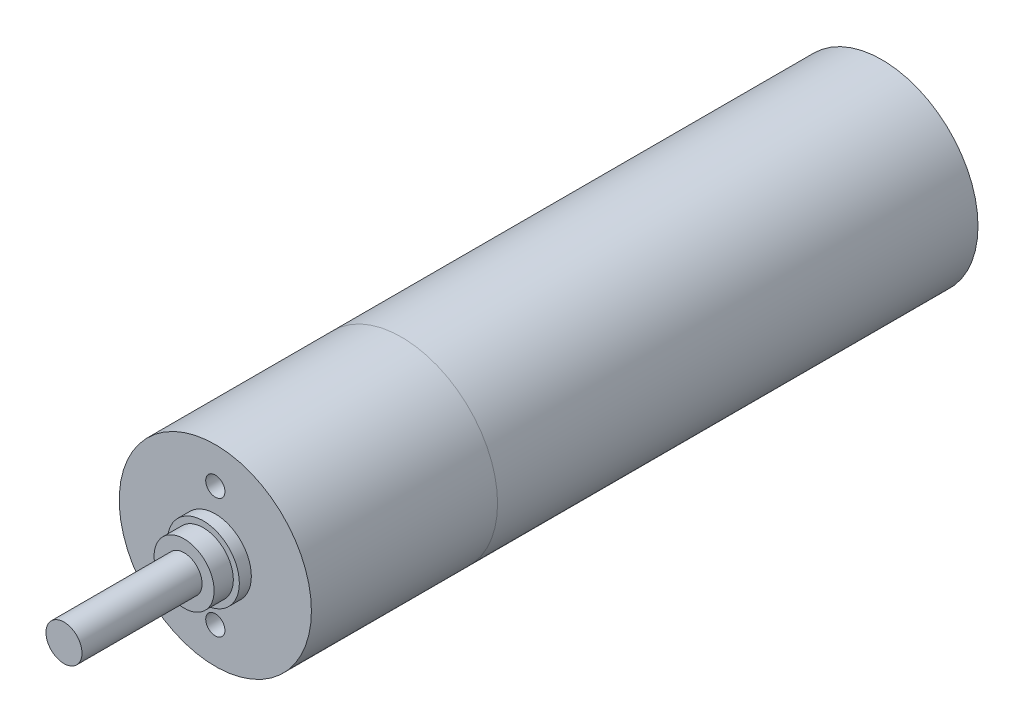
from build123d import *

# Parameters (mm, degrees)
SKETCH1_R                  = 8
EXTRUDE1_DEPTH             = 40
SKETCH2_R                  = 8
EXTRUDE2_DEPTH             = 15.5
SKETCH3_R                  = 3
EXTRUDE3_DEPTH             = 1
SKETCH4_R                  = 2.5
EXTRUDE4_DEPTH             = 1.6
SKETCH5_R                  = 1.5
EXTRUDE5_DEPTH             = 10
SKETCH6_R                  = 0.75
EXTRUDE6_DEPTH             = 3
M2_TAPPED_HOLE1_AT_2_COUNT = 2
M2_TAPPED_HOLE1_AT_2_PITCH = 10


with BuildPart() as part:
    # Sketch1 → Extrude1 (new body)
    with BuildSketch(Plane.XY):
        Circle(SKETCH1_R)
    extrude(amount=EXTRUDE1_DEPTH)


with BuildPart() as body_2:
    # Sketch2 → Extrude2 (new body)
    with BuildSketch(Plane.XY.offset(40)):
        Circle(SKETCH2_R)
    extrude(amount=EXTRUDE2_DEPTH)

    # Sketch3 → Extrude3 (add)
    with BuildSketch(Plane.XY.offset(55.5)):
        Circle(SKETCH3_R)
    extrude(amount=EXTRUDE3_DEPTH)

    # Sketch4 → Extrude4 (add)
    with BuildSketch(Plane.XY.offset(56.5)):
        Circle(SKETCH4_R)
    extrude(amount=EXTRUDE4_DEPTH)

    # Sketch5 → Extrude5 (add)
    with BuildSketch(Plane.XY.offset(58.1)):
        Circle(SKETCH5_R)
    extrude(amount=EXTRUDE5_DEPTH)

    # Sketch6 → Extrude6 (cut)
    with BuildSketch(Plane.XY.offset(55.5)):
        with Locations((0, 5)):
            Circle(SKETCH6_R)
        with Locations((0, -5)):
            Circle(SKETCH6_R)
    extrude(amount=-EXTRUDE6_DEPTH, mode=Mode.SUBTRACT)

    # Sketch7 → M2 Tapped Hole1 (revolve, cut)
    with BuildSketch(Plane(origin=(0, 5, 55.5), x_dir=(0, -1, 0), z_dir=(1, 0, 0))):
        Polygon((0, 0), (0, 3.480688495), (0.8, 3), (0.8, 0), align=None)
    m2_tapped_hole1 = revolve(axis=Axis((0, 5, 61.85), (0, 0, -1)), mode=Mode.SUBTRACT)

    # M2 Tapped Hole1 at 2: M2 Tapped Hole1 ×2
    with Locations(*[(0, -i * M2_TAPPED_HOLE1_AT_2_PITCH, 0) for i in range(1, M2_TAPPED_HOLE1_AT_2_COUNT)]):
        add(m2_tapped_hole1, mode=Mode.SUBTRACT)


solid = Compound([part.part, body_2.part])
